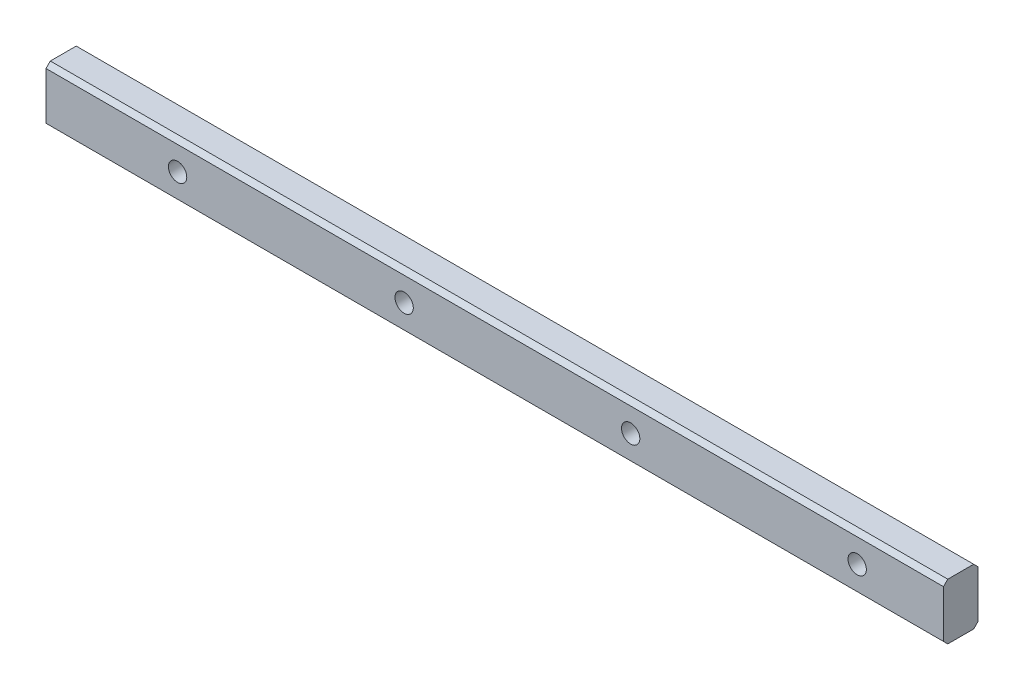
from build123d import *

# Parameters (mm, degrees)
SKETCH_1_W          = 416
SKETCH_1_H          = 28
EXTRUDE_677_DEPTH   = 16
FILLET_1_R          = 0.8
CUT_EXTRUDE_1_DEPTH = 417.542914956
CHAMFER_1_SIZE      = 2
HOLE_WIZARD_M10_1_D = 8.5


with BuildPart() as part:
    # 草图1 → Extrude 677 (new body)
    with BuildSketch(Plane.XY):
        Rectangle(SKETCH_1_W, SKETCH_1_H)
    extrude(amount=EXTRUDE_677_DEPTH)

    # 圆角1
    fillet_1_edges = [part.edges().sort_by_distance(p)[0] for p in [
        (0, -14, 16),
        (0, -14, 0),
        (0, 14, 0),
        (0, 14, 16),
    ]]
    fillet(fillet_1_edges, radius=FILLET_1_R)

    # 草图2 → 切除-拉伸1 (cut, through all)
    with BuildSketch(Plane.ZY.offset(208)):
        with BuildLine():
            Line((16, 13), (0, 13))
            Line((0, 13), (0, 13.2))
            ThreePointArc((0, 13.2), (0.234314575, 13.765685425), (0.8, 14))
            Line((0.8, 14), (15.2, 14))
            ThreePointArc((15.2, 14), (15.765685425, 13.765685425), (16, 13.2))
            Line((16, 13.2), (16, 13))
        make_face()
        with BuildLine():
            Line((16, -13), (0, -13))
            Line((0, -13), (0, -13.2))
            ThreePointArc((0, -13.2), (0.234314575, -13.765685425), (0.8, -14))
            Line((0.8, -14), (15.2, -14))
            ThreePointArc((15.2, -14), (15.765685425, -13.765685425), (16, -13.2))
            Line((16, -13.2), (16, -13))
        make_face()
    extrude(amount=-CUT_EXTRUDE_1_DEPTH, mode=Mode.SUBTRACT)

    # 倒角1
    chamfer_1_edges = [part.edges().sort_by_distance(p)[0] for p in [
        (0, 13, 16),
        (0, 13, 0),
        (0, -13, 16),
        (0, -13, 0),
    ]]
    chamfer(chamfer_1_edges, length=CHAMFER_1_SIZE)

    # M10 螺纹孔1 (through all)
    with Locations(Plane.XY.offset(16)):
        with Locations((-147, 0), (-42, 0), (63, 0), (168, 0)):
            Hole(HOLE_WIZARD_M10_1_D / 2)


solid = part.part
